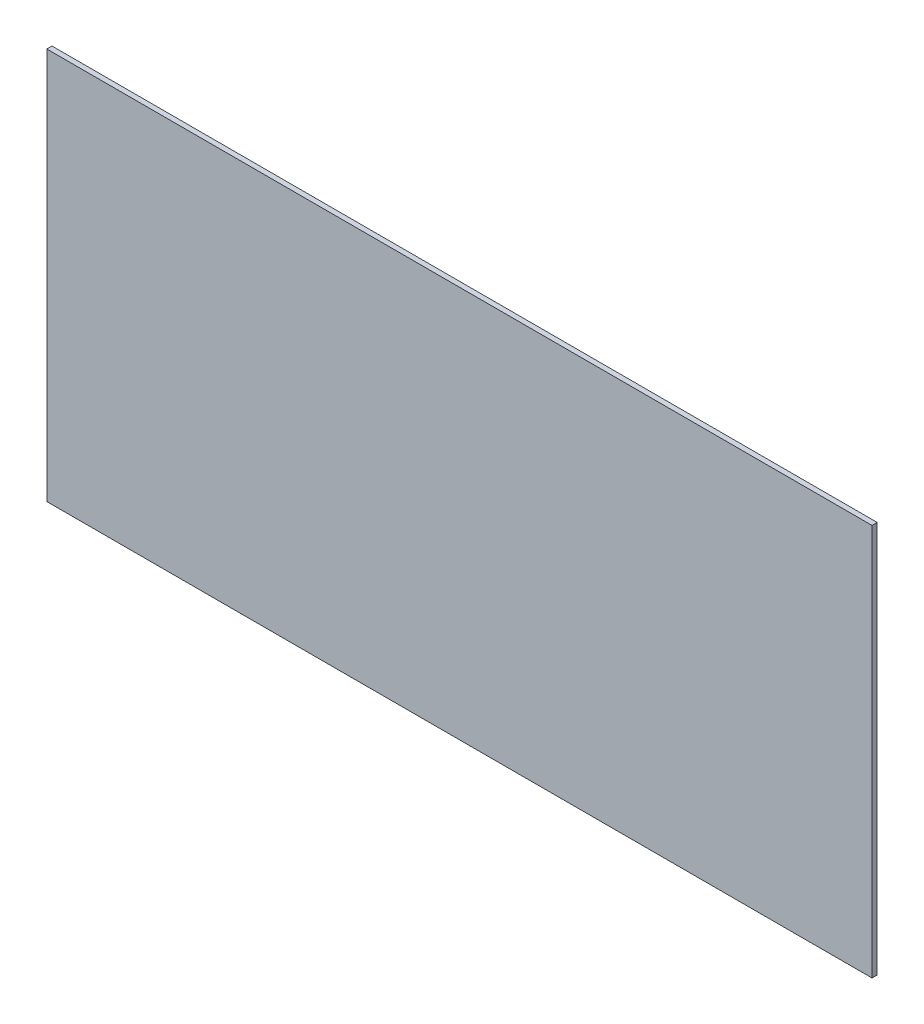
from build123d import *

# Parameters (mm, degrees)
SKETCH_1_W      = 160
SKETCH_1_H      = 76
EXTRUDE_1_DEPTH = 1


with BuildPart() as part:
    # 草图1 → 凸台-拉伸1 (new body)
    with BuildSketch(Plane.XY):
        with Locations((80, 38)):
            Rectangle(SKETCH_1_W, SKETCH_1_H)
    extrude(amount=EXTRUDE_1_DEPTH)


solid = part.part
